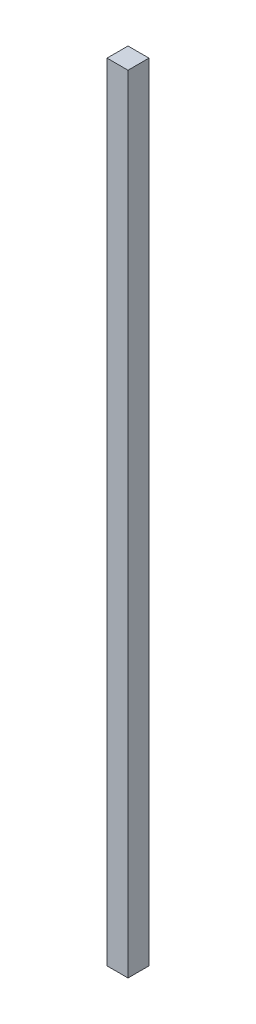
from build123d import *

# Parameters (mm, degrees)
SKETCH1_W           = 4
SKETCH1_H           = 4
BOSS_EXTRUDE1_DEPTH = 150


with BuildPart() as part:
    # Sketch1 → Boss-Extrude1 (new body)
    with BuildSketch(Plane(origin=(0, 0, 0), x_dir=(1, 0, 0), z_dir=(0, 1, 0))):
        Rectangle(SKETCH1_W, SKETCH1_H)
    extrude(amount=BOSS_EXTRUDE1_DEPTH)


solid = part.part
